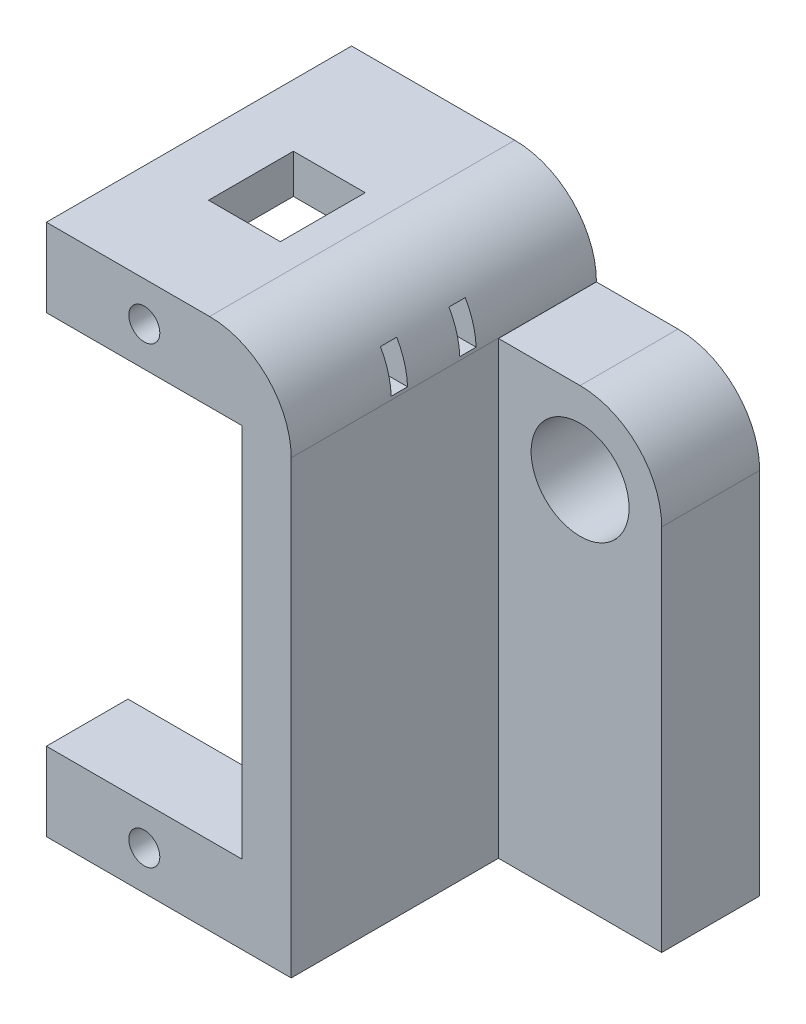
from build123d import *

# Parameters (mm, degrees)
SKETCH_1_W               = 12
SKETCH_1_H               = 4.8
SKETCH_1_R               = 0.95
EXTRUDE_1_DEPTH          = 5
EXTRUDE_1_2_DEPTH        = 5
SKETCH_2_W               = 15.7
SKETCH_2_H               = 32.6
EXTRUDE_2_DEPTH          = 3
SKETCH_3_W               = 3
SKETCH_3_H               = 32.6
EXTRUDE_3_DEPTH          = 10
SKETCH_6_R               = 3
CUT_EXTRUDE_1_DEPTH      = 38.872549426
SKETCH_7_W               = 10.7
SKETCH_7_H               = 4.8
EXTRUDE_5_DEPTH          = 12
SKETCH_9_W               = 4.4
SKETCH_9_H               = 5.2
CUT_EXTRUDE_2_DEPTH      = 2.5
SKETCH_10_W              = 4.4
SKETCH_10_H              = 1
CUT_EXTRUDE_3_DEPTH      = 2.5
CUT_EXTRUDE_4_DEPTH      = 12.5
CUT_EXTRUDE_4_DEPTH_BACK = 12.5
SKETCH_11_W              = 1
SKETCH_11_H              = 2.3
SKETCH_12_W              = 10.7
SKETCH_12_H              = 2.4
CUT_EXTRUDE_5_DEPTH      = 12
CUT_EXTRUDE_6_DEPTH      = 12
SKETCH_14_R              = 3
EXTRUDE_6_DEPTH          = 3
CUT_EXTRUDE_7_DEPTH      = 23


with BuildPart() as part:
    # 草图1 → 凸台-拉伸1 (new body)
    with BuildSketch(Plane.XY):
        Rectangle(SKETCH_1_W, SKETCH_1_H)
        Circle(SKETCH_1_R, mode=Mode.SUBTRACT)
    extrude(amount=EXTRUDE_1_DEPTH)



with BuildPart() as body_2:
    # 草图1 → Extrude 1 2 (new body)
    with BuildSketch(Plane.XY):
        with Locations((0, -27.8)):
            Rectangle(SKETCH_1_W, SKETCH_1_H)
        with Locations((0, -27.8)):
            Circle(SKETCH_1_R, mode=Mode.SUBTRACT)
    extrude(amount=EXTRUDE_1_2_DEPTH)


with BuildPart() as part_1:
    add(part.part)

    add(body_2.part)  # 凸台-拉伸2 merges body 2
    # 草图2 → 凸台-拉伸2 (add)
    with BuildSketch(Plane(origin=(6, 0, 0), x_dir=(0, 0, -1), z_dir=(1, 0, 0))):
        with Locations((2.85, -13.9)):
            Rectangle(SKETCH_2_W, SKETCH_2_H)
    extrude(amount=EXTRUDE_2_DEPTH)

    # 草图3 → 凸台-拉伸3 (add)
    with BuildSketch(Plane(origin=(9, 0, 0), x_dir=(0, 0, -1), z_dir=(1, 0, 0))):
        with Locations((9.2, -13.9)):
            Rectangle(SKETCH_3_W, SKETCH_3_H)
    extrude(amount=EXTRUDE_3_DEPTH)

    # 草图6 → 切除-拉伸1 (cut, through all)
    with BuildSketch(Plane.XY.offset(-7.7)):
        with Locations((14, -7.6169052)):
            Circle(SKETCH_6_R)
    extrude(amount=-CUT_EXTRUDE_1_DEPTH, mode=Mode.SUBTRACT)

    # 草图7 → 凸台-拉伸5 (add)
    with BuildSketch(Plane.ZY.offset(-6)):
        with Locations((-5.35, 0)):
            Rectangle(SKETCH_7_W, SKETCH_7_H)
    extrude(amount=EXTRUDE_5_DEPTH)

    # 草图9 → 切除-拉伸2 (cut)
    with BuildSketch(Plane(origin=(0, 2.4, 0), x_dir=(1, 0, 0), z_dir=(0, 1, 0))):
        with Locations((0, 3.734554069)):
            Rectangle(SKETCH_9_W, SKETCH_9_H)
    extrude(amount=-CUT_EXTRUDE_2_DEPTH, mode=Mode.SUBTRACT)

    # 草图10 → 切除-拉伸3 (cut)
    with BuildSketch(Plane(origin=(0, -0.1, 0), x_dir=(1, 0, 0), z_dir=(0, 1, 0))):
        with Locations((0, 5.834554069)):
            Rectangle(SKETCH_10_W, SKETCH_10_H)
        with Locations((0, 1.634554069)):
            Rectangle(SKETCH_10_W, SKETCH_10_H)
    extrude(amount=-CUT_EXTRUDE_3_DEPTH, mode=Mode.SUBTRACT)

    # 草图11 → 切除-拉伸4 (cut, two sides: drawn at the far end of the back side and taken through both)
    with BuildSketch(Plane.ZY.offset(-2.2).offset(-CUT_EXTRUDE_4_DEPTH_BACK)):
        with Locations((-1.634554069, -1.25)):
            Rectangle(SKETCH_11_W, SKETCH_11_H)
        with Locations((-5.834554069, -1.25)):
            Rectangle(SKETCH_11_W, SKETCH_11_H)
    extrude(amount=CUT_EXTRUDE_4_DEPTH + CUT_EXTRUDE_4_DEPTH_BACK, mode=Mode.SUBTRACT)

    # 草图12 → 切除-拉伸5 (cut)
    with BuildSketch(Plane.ZY.offset(6)):
        with Locations((-5.35, -1.2)):
            Rectangle(SKETCH_12_W, SKETCH_12_H)
    extrude(amount=-CUT_EXTRUDE_5_DEPTH, mode=Mode.SUBTRACT)

    # 草图13 → 切除-拉伸6 (cut)
    with BuildSketch(Plane.XY.offset(-7.7)):
        with BuildLine():
            Line((14, -2.6169052), (9, -2.6169052))
            Line((9, -2.6169052), (9, 2.4))
            Line((9, 2.4), (19, 2.4))
            Line((19, 2.4), (19, -7.6169052))
            ThreePointArc((19, -7.6169052), (17.535533906, -4.081371294), (14, -2.6169052))
        make_face()
    extrude(amount=-CUT_EXTRUDE_6_DEPTH, mode=Mode.SUBTRACT)

    # 草图14 → 凸台-拉伸6 (add)
    with BuildSketch(Plane(origin=(0, 0, -10.7), x_dir=(-1, 0, 0), z_dir=(0, 0, -1))):
        with BuildLine():
            Line((-19, -7.6169052), (-19, -30.2))
            Line((-19, -30.2), (-6, -30.2))
            Line((-6, -30.2), (-6, 0))
            Line((-6, 0), (6, 0))
            Line((6, 0), (6, 2.4))
            Line((6, 2.4), (-9, 2.4))
            Line((-9, 2.4), (-9, -2.6169052))
            Line((-9, -2.6169052), (-14, -2.6169052))
            ThreePointArc((-14, -2.6169052), (-17.535533906, -4.081371294), (-19, -7.6169052))
        make_face()
        with Locations(Location((-14, -7.6169052, 0), (0, 0, 180))):
            Circle(SKETCH_14_R, mode=Mode.SUBTRACT)
    extrude(amount=EXTRUDE_6_DEPTH)

    # 草图15 → 切除-拉伸7 (cut)
    with BuildSketch(Plane.XY.offset(5)):
        with BuildLine():
            Line((9, -2.6), (9, 2.4))
            Line((9, 2.4), (4, 2.4))
            ThreePointArc((4, 2.4), (7.535533906, 0.935533906), (9, -2.6))
        make_face()
    extrude(amount=-CUT_EXTRUDE_7_DEPTH, mode=Mode.SUBTRACT)


solid = part_1.part
